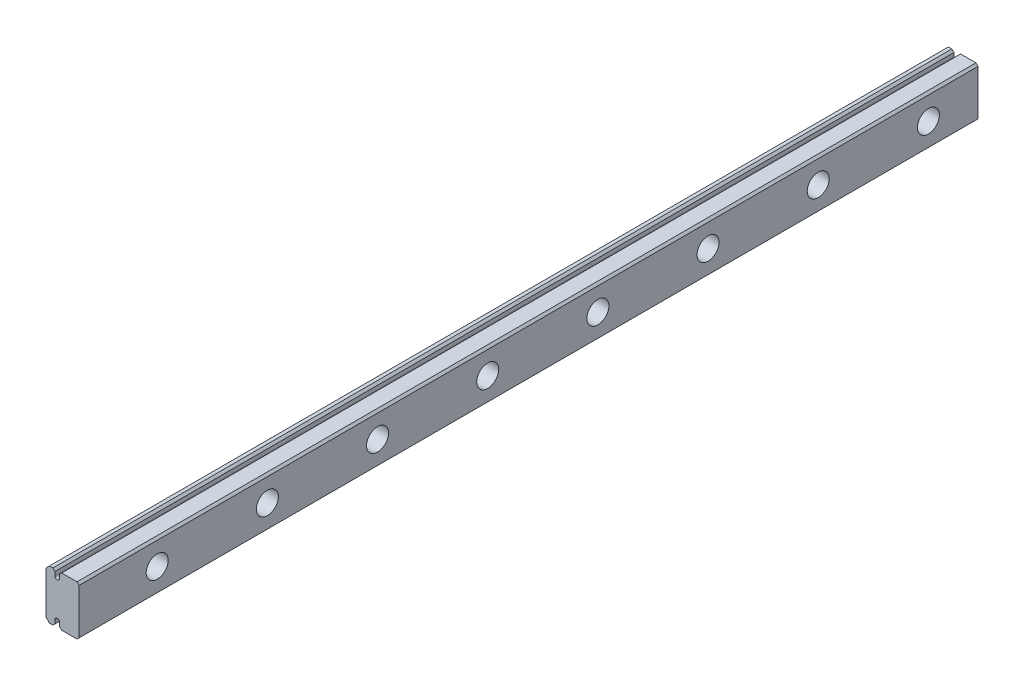
from build123d import *

# Parameters (mm, degrees)
BOSS_EXTRUDE4_DEPTH = 200
SKETCH3_R           = 2
CUT_EXTRUDE1_DEPTH  = 200
SKETCH3_3_R         = 3
SKETCH3_3_R_2       = 2
CUT_EXTRUDE2_DEPTH  = 2.5
SKETCH4_W           = 36.815771896
SKETCH4_H           = 9
CUT_EXTRUDE3_DEPTH  = 10


with BuildPart() as part:
    # Sketch1 → Boss-Extrude4 (new body)
    with BuildSketch(Plane.XY):
        with BuildLine():
            Line((10.168613541, -5.014716436), (10.168390302, 3.235283561))
            Line((10.168390302, 3.235283561), (9.793380155, 3.610273413))
            Line((9.793380155, 3.610273413), (7.005880156, 3.610197985))
            Line((7.005880156, 3.610197985), (6.630890303, 3.235187838))
            Line((6.630890303, 3.235187838), (6.630908906, 2.547687839))
            ThreePointArc((6.630908906, 2.547687839), (6.508267883, 2.251583555), (6.212170237, 2.128926508))
            ThreePointArc((6.212170237, 2.128926508), (5.916065954, 2.251567531), (5.793408907, 2.547665177))
            Line((5.793408907, 2.547665177), (5.793390303, 3.235165176))
            Line((5.793390303, 3.235165176), (5.418380156, 3.610155029))
            Line((5.418380156, 3.610155029), (4.793380156, 3.610138117))
            Line((4.793380156, 3.610138117), (4.168397069, 2.985121205))
            Line((4.168397069, 2.985121205), (4.168606778, -4.764878792))
            Line((4.168606778, -4.764878792), (4.79362369, -5.38986188))
            Line((4.79362369, -5.38986188), (5.41862369, -5.389844968))
            Line((5.41862369, -5.389844968), (5.793613542, -5.014834821))
            Line((5.793613542, -5.014834821), (5.793594939, -4.327334821))
            ThreePointArc((5.793594939, -4.327334821), (6.212333608, -3.90857349), (6.631094939, -4.327312159))
            Line((6.631094939, -4.327312159), (6.631113542, -5.014812159))
            Line((6.631113542, -5.014812159), (7.006123689, -5.389802011))
            Line((7.006123689, -5.389802011), (9.793623688, -5.389726583))
            Line((9.793623688, -5.389726583), (10.168613541, -5.014716436))
        make_face()
    extrude(amount=BOSS_EXTRUDE4_DEPTH)

    # Sketch3 → Cut-Extrude1 (cut)
    with BuildSketch(Plane(origin=(4.168477841, 0.000112796, 0), x_dir=(0, 0, 1), z_dir=(-0.999999999633898, -2.7059269393071615e-05, 0))):
        with Locations((9, -0.88999159)):
            Circle(SKETCH3_R)
        with Locations((29, -0.88999159)):
            Circle(SKETCH3_R)
        with Locations((49, -0.88999159)):
            Circle(SKETCH3_R)
        with Locations((69, -0.88999159)):
            Circle(SKETCH3_R)
        with Locations((89, -0.88999159)):
            Circle(SKETCH3_R)
        with Locations((109, -0.88999159)):
            Circle(SKETCH3_R)
        with Locations((129, -0.88999159)):
            Circle(SKETCH3_R)
        with Locations((149, -0.88999159)):
            Circle(SKETCH3_R)
        with Locations((169, -0.88999159)):
            Circle(SKETCH3_R)
        with Locations((189, -0.88999159)):
            Circle(SKETCH3_R)
    extrude(amount=-CUT_EXTRUDE1_DEPTH, mode=Mode.SUBTRACT)

    # Sketch3<3> → Cut-Extrude2 (cut)
    # profile 1 of 10: a face of its own
    with BuildSketch(Plane(origin=(4.168477841, 0.000112796, 0), x_dir=(0, 0, 1), z_dir=(-0.999999999633898, -2.7059269393071615e-05, 0))):
        with Locations((9, -0.88999159)):
            Circle(SKETCH3_3_R)
        with Locations((9, -0.88999159)):
            Circle(SKETCH3_3_R_2, mode=Mode.SUBTRACT)
    # profile 2 of 10: a face of its own
    with BuildSketch(Plane(origin=(4.168477841, 0.000112796, 0), x_dir=(0, 0, 1), z_dir=(-0.999999999633898, -2.7059269393071615e-05, 0))):
        with Locations((29, -0.88999159)):
            Circle(SKETCH3_3_R)
        with Locations((29, -0.88999159)):
            Circle(SKETCH3_3_R_2, mode=Mode.SUBTRACT)
    # profile 3 of 10: a face of its own
    with BuildSketch(Plane(origin=(4.168477841, 0.000112796, 0), x_dir=(0, 0, 1), z_dir=(-0.999999999633898, -2.7059269393071615e-05, 0))):
        with Locations((49, -0.88999159)):
            Circle(SKETCH3_3_R)
        with Locations((49, -0.88999159)):
            Circle(SKETCH3_3_R_2, mode=Mode.SUBTRACT)
    # profile 4 of 10: a face of its own
    with BuildSketch(Plane(origin=(4.168477841, 0.000112796, 0), x_dir=(0, 0, 1), z_dir=(-0.999999999633898, -2.7059269393071615e-05, 0))):
        with Locations((69, -0.88999159)):
            Circle(SKETCH3_3_R)
        with Locations((69, -0.88999159)):
            Circle(SKETCH3_3_R_2, mode=Mode.SUBTRACT)
    # profile 5 of 10: a face of its own
    with BuildSketch(Plane(origin=(4.168477841, 0.000112796, 0), x_dir=(0, 0, 1), z_dir=(-0.999999999633898, -2.7059269393071615e-05, 0))):
        with Locations((89, -0.88999159)):
            Circle(SKETCH3_3_R)
        with Locations((89, -0.88999159)):
            Circle(SKETCH3_3_R_2, mode=Mode.SUBTRACT)
    # profile 6 of 10: a face of its own
    with BuildSketch(Plane(origin=(4.168477841, 0.000112796, 0), x_dir=(0, 0, 1), z_dir=(-0.999999999633898, -2.7059269393071615e-05, 0))):
        with Locations((109, -0.88999159)):
            Circle(SKETCH3_3_R)
    # profile 7 of 10: a face of its own
    with BuildSketch(Plane(origin=(4.168477841, 0.000112796, 0), x_dir=(0, 0, 1), z_dir=(-0.999999999633898, -2.7059269393071615e-05, 0))):
        with Locations((129, -0.88999159)):
            Circle(SKETCH3_3_R)
    # profile 8 of 10: a face of its own
    with BuildSketch(Plane(origin=(4.168477841, 0.000112796, 0), x_dir=(0, 0, 1), z_dir=(-0.999999999633898, -2.7059269393071615e-05, 0))):
        with Locations((149, -0.88999159)):
            Circle(SKETCH3_3_R)
    # profile 9 of 10: a face of its own
    with BuildSketch(Plane(origin=(4.168477841, 0.000112796, 0), x_dir=(0, 0, 1), z_dir=(-0.999999999633898, -2.7059269393071615e-05, 0))):
        with Locations((169, -0.88999159)):
            Circle(SKETCH3_3_R)
    # profile 10 of 10: a face of its own
    with BuildSketch(Plane(origin=(4.168477841, 0.000112796, 0), x_dir=(0, 0, 1), z_dir=(-0.999999999633898, -2.7059269393071615e-05, 0))):
        with Locations((189, -0.88999159)):
            Circle(SKETCH3_3_R)
    extrude(amount=-CUT_EXTRUDE2_DEPTH, mode=Mode.SUBTRACT)

    # Sketch4 → Cut-Extrude3 (cut)
    with BuildSketch(Plane(origin=(10.168477839, 0.000275152, 0), x_dir=(0, 0, -1), z_dir=(0.999999999633898, 2.7059269386201862e-05, 0))):
        with Locations((-181.592114052, -0.88999159)):
            Rectangle(SKETCH4_W, SKETCH4_H)
    extrude(amount=-CUT_EXTRUDE3_DEPTH, mode=Mode.SUBTRACT)


solid = part.part
